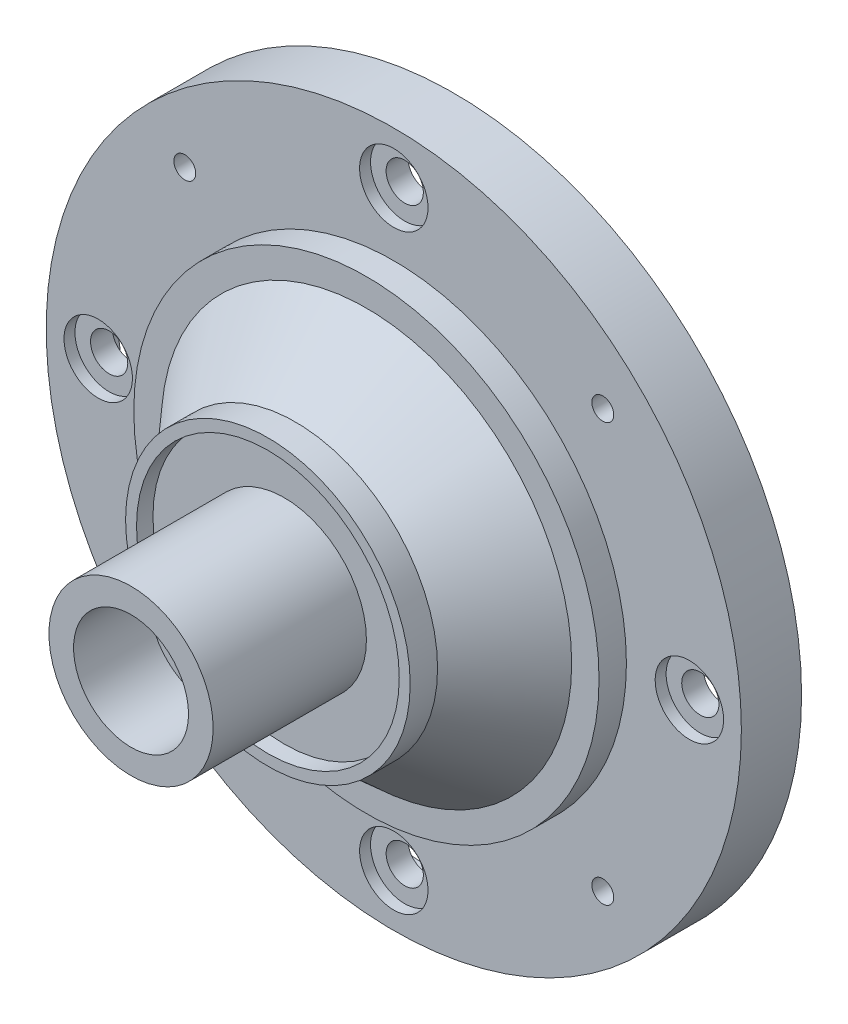
from build123d import *
from build123d.topology import SkipClean

# Parameters (mm, degrees)
EXTRUDE_1_DEPTH          = 12
PATTERN_CIRCULAR_1_COUNT = 4
RIB_1_REACH              = 114.643
SKETCH_4_WALL_W          = 251.024101548
SKETCH_4_WALL_H          = 1
PATTERN_CIRCULAR_2_COUNT = 8
SKETCH_6_R               = 3.4
CUT_EXTRUDE_1_DEPTH      = 105.276075876
SKETCH_7_R               = 6.25
CUT_EXTRUDE_2_DEPTH      = 2
PATTERN_CIRCULAR_3_COUNT = 4
SKETCH_8_R               = 2
CUT_EXTRUDE_3_DEPTH      = 105.276075876
PATTERN_CIRCULAR_4_COUNT = 4
EXTRUDE_START            = 1
SKETCH_9_R               = 5.25
SKETCH_9_R_2             = 3.4
EXTRUDE_2_DEPTH          = 1
PATTERN_CIRCULAR_5_COUNT = 4


with BuildPart() as part:
    # 草图1 → 旋转1 (revolve)
    with BuildSketch(Plane(origin=(0, 0, 0), x_dir=(0, 0, -1), z_dir=(1, 0, 0)), mode=Mode.PRIVATE) as revolve_1_sk:
        Polygon((0, 10.5), (0, 15), (28, 15), (28, 24), (25, 24), (25, 26), (30, 26), (43, 37.5), (43, 42.5), (48, 42.5), (48, 63.5), (59, 63.5), (59, 61.5), (53, 61.5), (53, 40.5), (45, 40.5), (45, 37.5), (56, 37.5), (56, 35.5), (43.757661732, 35.5), (30, 23.329760776), (30, 12), (51, 12), (51, 8.5), (14, 8.5), (14, 10.5), align=None)
    revolve(revolve_1_sk.sketch.rotate(Axis((0, 0, 0), (0, 0, -1)), 90), axis=Axis((0, 0, 0), (0, 0, -1)))

    # 草图3 → 凸台-拉伸1 (add)
    with BuildSketch(Plane(origin=(0, 0, -56), x_dir=(-1, 0, 0), z_dir=(0, 0, -1))):
        with BuildLine():
            Line((0, -37.5), (0, -35.5))
            ThreePointArc((0, -35.5), (-2.506253606, -35.411420373), (-5, -35.146123542))
            Line((-5, -35.146123542), (-5, -37.165171868))
            ThreePointArc((-5, -37.165171868), (-2.505599224, -37.416199333), (0, -37.5))
        make_face()
        with BuildLine():
            ThreePointArc((5, -35.146123542), (2.506253606, -35.411420373), (0, -35.5))
            Line((0, -35.5), (0, -37.5))
            ThreePointArc((0, -37.5), (2.505599224, -37.416199333), (5, -37.165171868))
            Line((5, -37.165171868), (5, -35.146123542))
        make_face()
    extrude_1 = extrude(amount=EXTRUDE_1_DEPTH)

    # 阵列(圆周)1: 凸台-拉伸1 ×4 about axis
    with SkipClean():  # the faces are left unmerged after this step: merging them gives an invalid solid
        pattern_circular_1_axis = Axis((0, 0, 0), (0, 0, 1))
        for i in range(1, PATTERN_CIRCULAR_1_COUNT):
            add(extrude_1.rotate(pattern_circular_1_axis, i * 360 / PATTERN_CIRCULAR_1_COUNT))

    # 草图4 wall → 筋1 (add, up to next)
    with BuildSketch(Plane(origin=(-23.810679894, 0, -50), x_dir=(-1, 0, 0), z_dir=(0, 0, 1)), mode=Mode.PRIVATE) as rib_1_sk1:
        Rectangle(SKETCH_4_WALL_W, SKETCH_4_WALL_H)
    rib_1_tool1 = extrude(rib_1_sk1.sketch, amount=RIB_1_REACH, mode=Mode.PRIVATE) - part.part
    rib_1 = rib_1_tool1.solids().sort_by_distance((-23.810679894, 0, -50))[0]
    add(rib_1)

    # 阵列(圆周)2: 筋1 ×8 about axis
    with SkipClean():  # the faces are left unmerged after this step: merging them gives an invalid solid
        pattern_circular_2_axis = Axis((0, 0, 0), (0, 0, 1))
        for i in range(1, PATTERN_CIRCULAR_2_COUNT):
            add(rib_1.rotate(pattern_circular_2_axis, i * 360 / PATTERN_CIRCULAR_2_COUNT))

    # 草图6 → 切除-拉伸1 (cut, symmetric)
    with SkipClean():  # the faces are left unmerged after this step: merging them gives an invalid solid
        with BuildSketch(Plane(origin=(0, 0, -53), x_dir=(-1, 0, 0), z_dir=(0, 0, -1))):
            with Locations((0, 54)):
                Circle(SKETCH_6_R)
        cut_extrude_1 = extrude(amount=CUT_EXTRUDE_1_DEPTH, both=True, mode=Mode.SUBTRACT)

    # 草图7 → 切除-拉伸2 (cut)
    with SkipClean():  # the faces are left unmerged after this step: merging them gives an invalid solid
        with BuildSketch(Plane.XY.offset(-48)):
            with Locations((0, 54)):
                Circle(SKETCH_7_R)
        cut_extrude_2 = extrude(amount=-CUT_EXTRUDE_2_DEPTH, mode=Mode.SUBTRACT)

    # 阵列(圆周)3: 切除-拉伸1, 切除-拉伸2 ×4 about axis
    with SkipClean():  # the faces are left unmerged after this step: merging them gives an invalid solid
        pattern_circular_3_axis = Axis((0, 0, 0), (0, 0, 1))
        add([cut_extrude_1.rotate(pattern_circular_3_axis, i * 360 / PATTERN_CIRCULAR_3_COUNT) for i in range(1, PATTERN_CIRCULAR_3_COUNT)], mode=Mode.SUBTRACT)
        add([cut_extrude_2.rotate(pattern_circular_3_axis, i * 360 / PATTERN_CIRCULAR_3_COUNT) for i in range(1, PATTERN_CIRCULAR_3_COUNT)], mode=Mode.SUBTRACT)

    # 草图8 → 切除-拉伸3 (cut, through all)
    with SkipClean():  # the faces are left unmerged after this step: merging them gives an invalid solid
        with BuildSketch(Plane(origin=(0, 0, -53), x_dir=(-1, 0, 0), z_dir=(0, 0, -1))):
            with Locations((38.183766184, 38.183766184)):
                Circle(SKETCH_8_R)
        cut_extrude_3 = extrude(amount=-CUT_EXTRUDE_3_DEPTH, mode=Mode.SUBTRACT)

    # 阵列(圆周)4: 切除-拉伸3 ×4 about axis
    with SkipClean():  # the faces are left unmerged after this step: merging them gives an invalid solid
        pattern_circular_4_axis = Axis((0, 0, 0), (0, 0, 1))
        for i in range(1, PATTERN_CIRCULAR_4_COUNT):
            add(cut_extrude_3.rotate(pattern_circular_4_axis, i * 360 / PATTERN_CIRCULAR_4_COUNT), mode=Mode.SUBTRACT)

    # 草图9 → 凸台-拉伸2 (add)
    with SkipClean():  # the faces are left unmerged after this step: merging them gives an invalid solid
        with BuildSketch(Plane(origin=(0, 0, -53), x_dir=(-1, 0, 0), z_dir=(0, 0, -1)).offset(EXTRUDE_START)):
            with Locations(Location((0, 54, 0), (0, 0, 180))):
                Circle(SKETCH_9_R)
            with Locations((0, 54)):
                Circle(SKETCH_9_R_2, mode=Mode.SUBTRACT)
        extrude_2 = extrude(amount=-EXTRUDE_2_DEPTH)

    # 阵列(圆周)5: 凸台-拉伸2 ×4 about axis
    with SkipClean():  # the faces are left unmerged after this step: merging them gives an invalid solid
        pattern_circular_5_axis = Axis((0, 0, 0), (0, 0, 1))
        for i in range(1, PATTERN_CIRCULAR_5_COUNT):
            add(extrude_2.rotate(pattern_circular_5_axis, i * 360 / PATTERN_CIRCULAR_5_COUNT))


solid = part.part
